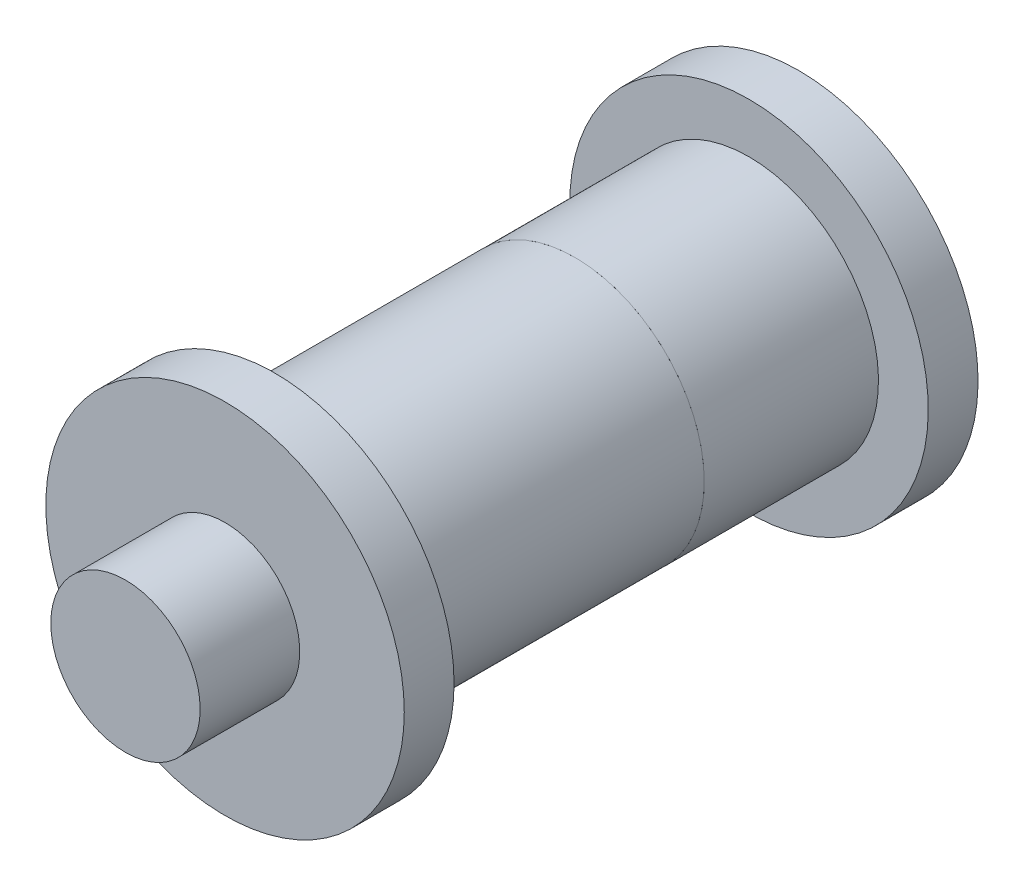
from build123d import *

# Parameters (mm, degrees)
SKETCH4_R               = 1.6
CUT_EXTRUDE2_DEPTH      = 0.5
CUT_EXTRUDE1_DEPTH      = 18.35172902
CUT_EXTRUDE1_DEPTH_BACK = 18.35172902
SKETCH6_R               = 3
BOSS_EXTRUDE2_DEPTH     = 4


with BuildPart() as part:
    # Sketch2 → Revolve1 (revolve)
    with BuildSketch(Plane(origin=(0, 0, 0), x_dir=(0, 0, -1), z_dir=(1, 0, 0))):
        Polygon((0, 0), (0, 5.2), (7, 5.2), (7, 7.2), (9, 7.2), (9, 2.5), (11, 2.5), (11, 0), align=None)
    revolve(axis=Axis((0, 0, -11), (0, 0, 1)))

    # Sketch4 → Cut-Extrude2 (cut)
    with BuildSketch(Plane(origin=(0, 0, -11), x_dir=(-1, 0, 0), z_dir=(0, 0, -1))):
        with Locations(Location((0, 0, 0), (0, 0, 90))):
            Circle(SKETCH4_R)
    extrude(amount=-CUT_EXTRUDE2_DEPTH, mode=Mode.SUBTRACT)


with BuildPart() as body_2:
    # Sketch5 → Revolve2 (revolve)
    with BuildSketch(Plane(origin=(0, 0, 0), x_dir=(0, 0, -1), z_dir=(1, 0, 0)), mode=Mode.PRIVATE) as revolve2_sk:
        Polygon((0, 0), (0, 5.2), (-12.05, 5.2), (-12.05, 7.2), (-14.05, 7.2), (-14.05, 0), align=None)
    revolve(revolve2_sk.sketch.rotate(Axis((0, 0, 14.05), (0, 0, -1)), 90), axis=Axis((0, 0, 14.05), (0, 0, -1)))


with BuildPart() as cut_extrude1_tool:
    # Sketch3 → Cut-Extrude1 (new, two sides: drawn at the far end of the back side and taken through both)
    with BuildSketch(Plane.XY.offset(-CUT_EXTRUDE1_DEPTH_BACK)):
        with BuildLine():
            Line((-1.161895004, 1.1), (1.161895004, 1.1))
            ThreePointArc((1.161895004, 1.1), (0, -1.6), (-1.161895004, 1.1))
        make_face()
    extrude(amount=CUT_EXTRUDE1_DEPTH + CUT_EXTRUDE1_DEPTH_BACK)


with BuildPart() as part_1:
    add(part.part)

    # Cut-Extrude1: cut by cut_extrude1_tool
    add(cut_extrude1_tool.part, mode=Mode.SUBTRACT)


with BuildPart() as body_2_1:
    add(body_2.part)

    # Cut-Extrude1: cut by cut_extrude1_tool
    add(cut_extrude1_tool.part, mode=Mode.SUBTRACT)

    # Sketch6 → Boss-Extrude2 (add)
    with BuildSketch(Plane.XY.offset(14.05)):
        with Locations(Location((0, 0, 0), (0, 0, 180))):
            Circle(SKETCH6_R)
    extrude(amount=BOSS_EXTRUDE2_DEPTH)


solid = Compound([part_1.part, body_2_1.part])
